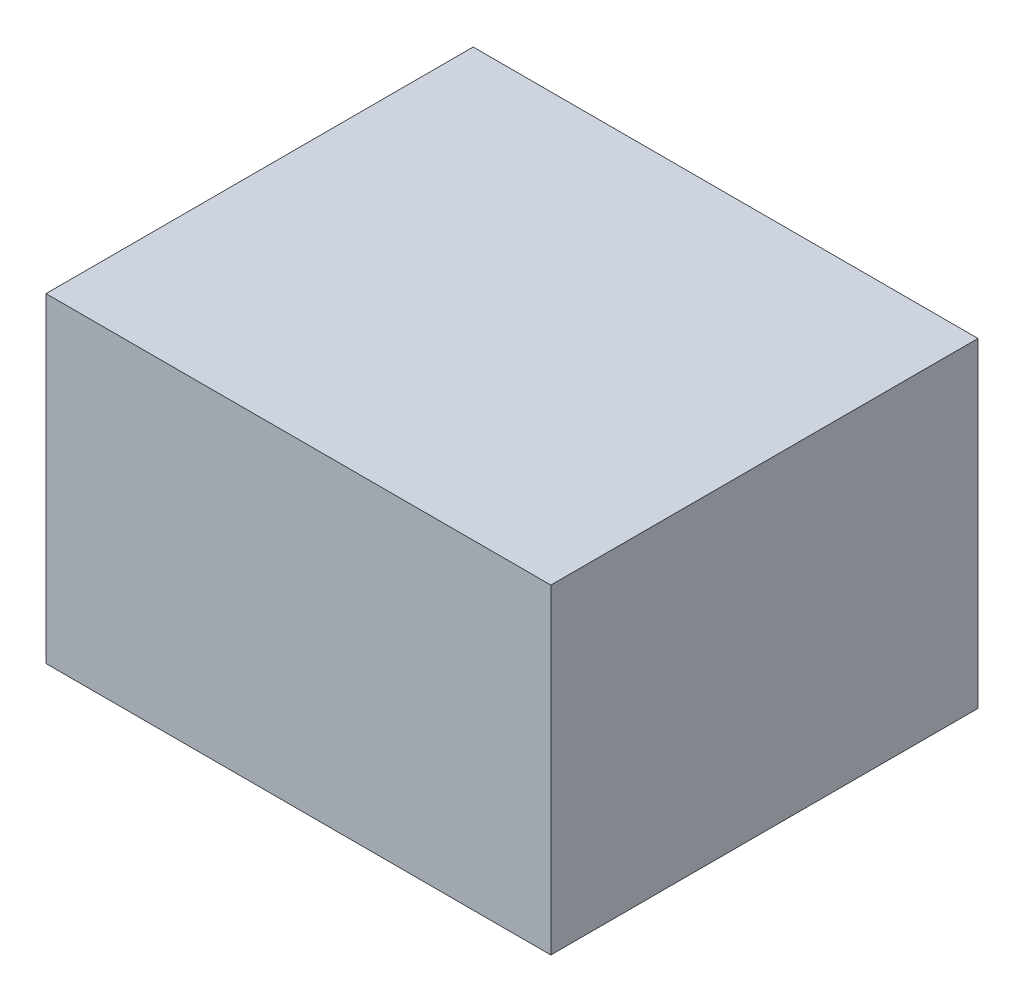
from build123d import *

# Parameters (mm, degrees)
SKETCH1_W      = 6.604
SKETCH1_H      = 5.588
EXTRUDE1_DEPTH = 4.191


with BuildPart() as part:
    # Sketch1 → Extrude1 (new body)
    with BuildSketch(Plane(origin=(0, 0, 0), x_dir=(1, 0, 0), z_dir=(0, 1, 0))):
        with Locations((3.302, 2.794)):
            Rectangle(SKETCH1_W, SKETCH1_H)
    extrude(amount=EXTRUDE1_DEPTH)


solid = part.part
